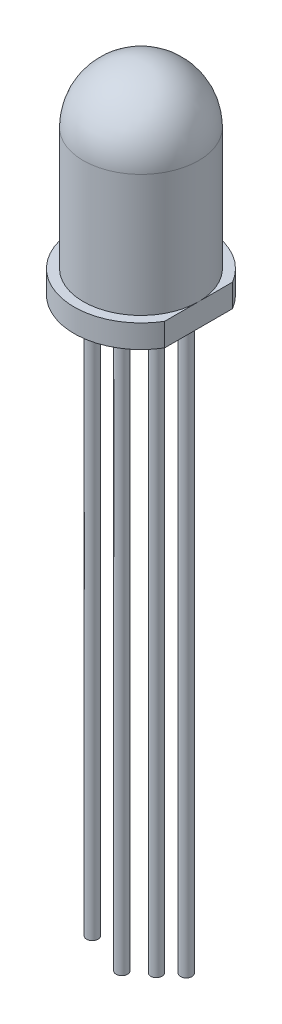
from build123d import *

# Parameters (mm, degrees)
CUT_EXTRUDE1_REACH      = 11.709
SKETCH8_R               = 0.25
BOSS_EXTRUDE1_DEPTH     = 26.5
CUT_EXTRUDE2_DEPTH      = 34.05540803
CUT_EXTRUDE2_DEPTH_BACK = 34.05540803


with BuildPart() as part:
    # Sketch4 → Revolve1 (revolve)
    with BuildSketch(Plane.XY, mode=Mode.PRIVATE) as revolve1_sk:
        with BuildLine():
            Line((0, 2.5), (0, -6.3))
            Line((0, -6.3), (2.9, -6.3))
            Line((2.9, -6.3), (2.9, -5.3))
            Line((2.9, -5.3), (2.5, -5.3))
            Line((2.5, -5.3), (2.5, 0))
            ThreePointArc((2.5, 0), (1.767766953, 1.767766953), (0, 2.5))
        make_face()
    revolve(revolve1_sk.sketch.rotate(Axis((0, 2.5, 0), (0, -1, 0)), 180), axis=Axis((0, 2.5, 0), (0, -1, 0)))

    # Sketch7 → Cut-Extrude1 (cut, up to next)
    with BuildSketch(Plane(origin=(0, -6.3, 0), x_dir=(-1, 0, 0), z_dir=(0, -1, 0)), mode=Mode.PRIVATE) as cut_extrude1_sk1:
        with BuildLine():
            Line((-2.5, 1.469693846), (-2.5, -1.469693846))
            ThreePointArc((-2.5, -1.469693846), (-2.9, 0), (-2.5, 1.469693846))
        make_face()
    cut_extrude1_tool1 = extrude(cut_extrude1_sk1.sketch, amount=-CUT_EXTRUDE1_REACH, mode=Mode.PRIVATE) & part.part
    add(cut_extrude1_tool1.solids().sort_by_distance((2.660985, -6.3, 0))[0], mode=Mode.SUBTRACT)

    # Sketch8 → Boss-Extrude1 (add)
    with BuildSketch(Plane(origin=(0, -6.3, 0), x_dir=(-1, 0, 0), z_dir=(0, -1, 0))):
        with Locations((-1.966028559, 0)):
            Circle(SKETCH8_R)
        with Locations((-0.669516841, 0)):
            Circle(SKETCH8_R)
        with Locations((0.828847001, 0)):
            Circle(SKETCH8_R)
        with Locations((2.109831632, 0)):
            Circle(SKETCH8_R)
    extrude(amount=BOSS_EXTRUDE1_DEPTH)

    # Sketch9 → Cut-Extrude2 (cut, two sides: drawn at the far end of the back side and taken through both)
    with BuildSketch(Plane.XY.offset(-CUT_EXTRUDE2_DEPTH_BACK)):
        Polygon((2.216028559, -30.801737738), (1.716028559, -30.801737738), (0.919516841, -31.436646975), (0.419516841, -31.436646975), (-0.318229125, -32.112599285), (-1.342625606, -32.112599285), (-1.859831632, -31.436646975), (-2.359831632, -31.436646975), (-2.359831632, -33.265580611), (2.627654793, -33.265580611), (2.686516226, -30.801737738), align=None)
    extrude(amount=CUT_EXTRUDE2_DEPTH + CUT_EXTRUDE2_DEPTH_BACK, mode=Mode.SUBTRACT)


solid = part.part
